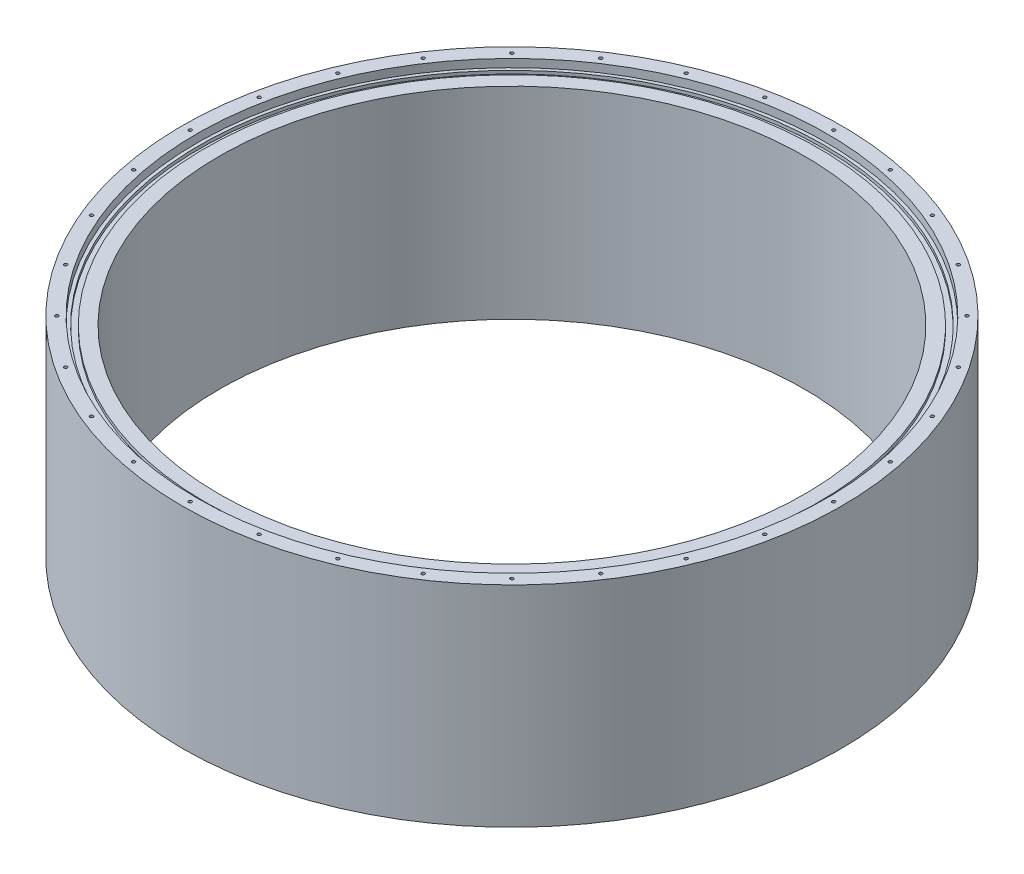
from build123d import *

# Parameters (mm, degrees)
SKETCH2_W                 = 4.1656
SKETCH2_H                 = 2.413
CIRPATTERN1_COUNT         = 32
F_5_0MM_DOWEL_HOLE1_D     = 5.05
F_5_0MM_DOWEL_HOLE1_DEPTH = 6
F_5_0MM_DOWEL_HOLE1_TIP   = 1.517173063


with BuildPart() as part:
    # Sketch1 → Revolve1 (revolve)
    with BuildSketch(Plane.XY, mode=Mode.PRIVATE) as revolve1_sk:
        Polygon((225.6, 74.685), (243, 74.685), (243, 80.885), (254, 80.885), (254, -80.885), (225.6, -80.885), align=None)
    revolve(revolve1_sk.sketch.rotate(Axis((0, 80.885, 0), (0, -1, 0)), 90), axis=Axis((0, 80.885, 0), (0, -1, 0)))

    # Sketch2 → Cut-Revolve1 (revolve, cut)
    with BuildSketch(Plane.XY, mode=Mode.PRIVATE) as cut_revolve1_sk:
        with Locations((238.4172, 73.4785)):
            Rectangle(SKETCH2_W, SKETCH2_H)
    revolve(cut_revolve1_sk.sketch.rotate(Axis((0, 80.885, 0), (0, -1, 0)), 90), axis=Axis((0, 80.885, 0), (0, -1, 0)), mode=Mode.SUBTRACT)

    # Sketch4 → M3x0.5 Tapped Hole1 (revolve, cut)
    with BuildSketch(Plane(origin=(248, 80.885, 0), x_dir=(0, 0, 1), z_dir=(1, 0, 0))):
        Polygon((0, 0), (0, 10.251075774), (1.25, 9.5), (1.25, 0), align=None)
    m3x0_5_tapped_hole1 = revolve(axis=Axis((248, 87.235, 0), (0, -1, 0)), mode=Mode.SUBTRACT)

    # CirPattern1: M3x0.5 Tapped Hole1 ×32 about axis
    cirpattern1_axis = Axis((0, 0, 0), (0, 1, 0))
    for i in range(1, CIRPATTERN1_COUNT):
        add(m3x0_5_tapped_hole1.rotate(cirpattern1_axis, i * 360 / CIRPATTERN1_COUNT), mode=Mode.SUBTRACT)

    # Mirror1: M3x0.5 Tapped Hole1 across plane
    add(m3x0_5_tapped_hole1.mirror(Plane.ZX), mode=Mode.SUBTRACT)

    # Mirror1 copy 1 sketch → Mirror1 copy 1 (revolve, cut)
    with BuildSketch(Plane(origin=(243.23474954, -80.885, -48.38239986), x_dir=(0.19509032201612825, 0, 0.9807852804032304), z_dir=(0.9807852804032304, 0, -0.19509032201612825))):
        Polygon((0, 0), (0, -10.251075774), (1.25, -9.5), (1.25, 0), align=None)
    revolve(axis=Axis((243.23474954, -87.235, -48.38239986), (0, -1, 0)), mode=Mode.SUBTRACT)

    # Mirror1 copy 2 sketch → Mirror1 copy 2 (revolve, cut)
    with BuildSketch(Plane(origin=(229.122124063, -80.885, -94.905491227), x_dir=(0.3826834323650898, 0, 0.9238795325112867), z_dir=(0.9238795325112867, 0, -0.3826834323650898))):
        Polygon((0, 0), (0, -10.251075774), (1.25, -9.5), (1.25, 0), align=None)
    revolve(axis=Axis((229.122124063, -87.235, -94.905491227), (0, -1, 0)), mode=Mode.SUBTRACT)

    # Mirror1 copy 3 sketch → Mirror1 copy 3 (revolve, cut)
    with BuildSketch(Plane(origin=(206.204463851, -80.885, -137.781417789), x_dir=(0.5555702330196022, 0, 0.8314696123025452), z_dir=(0.8314696123025452, 0, -0.5555702330196022))):
        Polygon((0, 0), (0, -10.251075774), (1.25, -9.5), (1.25, 0), align=None)
    revolve(axis=Axis((206.204463851, -87.235, -137.781417789), (0, -1, 0)), mode=Mode.SUBTRACT)

    # Mirror1 copy 4 sketch → Mirror1 copy 4 (revolve, cut)
    with BuildSketch(Plane(origin=(175.362481734, -80.885, -175.362481734), x_dir=(0.7071067811865475, 0, 0.7071067811865476), z_dir=(0.7071067811865476, 0, -0.7071067811865475))):
        Polygon((0, 0), (0, -10.251075774), (1.25, -9.5), (1.25, 0), align=None)
    revolve(axis=Axis((175.362481734, -87.235, -175.362481734), (0, -1, 0)), mode=Mode.SUBTRACT)

    # Mirror1 copy 5 sketch → Mirror1 copy 5 (revolve, cut)
    with BuildSketch(Plane(origin=(137.781417789, -80.885, -206.204463851), x_dir=(0.8314696123025452, 0, 0.5555702330196023), z_dir=(0.5555702330196023, 0, -0.8314696123025452))):
        Polygon((0, 0), (0, -10.251075774), (1.25, -9.5), (1.25, 0), align=None)
    revolve(axis=Axis((137.781417789, -87.235, -206.204463851), (0, -1, 0)), mode=Mode.SUBTRACT)

    # Mirror1 copy 6 sketch → Mirror1 copy 6 (revolve, cut)
    with BuildSketch(Plane(origin=(94.905491227, -80.885, -229.122124063), x_dir=(0.9238795325112867, 0, 0.38268343236508984), z_dir=(0.38268343236508984, 0, -0.9238795325112867))):
        Polygon((0, 0), (0, -10.251075774), (1.25, -9.5), (1.25, 0), align=None)
    revolve(axis=Axis((94.905491227, -87.235, -229.122124063), (0, -1, 0)), mode=Mode.SUBTRACT)

    # Mirror1 copy 7 sketch → Mirror1 copy 7 (revolve, cut)
    with BuildSketch(Plane(origin=(48.38239986, -80.885, -243.23474954), x_dir=(0.9807852804032304, 0, 0.19509032201612833), z_dir=(0.19509032201612833, 0, -0.9807852804032304))):
        Polygon((0, 0), (0, -10.251075774), (1.25, -9.5), (1.25, 0), align=None)
    revolve(axis=Axis((48.38239986, -87.235, -243.23474954), (0, -1, 0)), mode=Mode.SUBTRACT)

    # Mirror1 copy 8 sketch → Mirror1 copy 8 (revolve, cut)
    with BuildSketch(Plane(origin=(0, -80.885, -248), x_dir=(1, 0, 0), z_dir=(0, 0, -1))):
        Polygon((0, 0), (0, -10.251075774), (1.25, -9.5), (1.25, 0), align=None)
    revolve(axis=Axis((0, -87.235, -248), (0, -1, 0)), mode=Mode.SUBTRACT)

    # Mirror1 copy 9 sketch → Mirror1 copy 9 (revolve, cut)
    with BuildSketch(Plane(origin=(-48.38239986, -80.885, -243.23474954), x_dir=(0.9807852804032304, 0, -0.1950903220161282), z_dir=(-0.1950903220161282, 0, -0.9807852804032304))):
        Polygon((0, 0), (0, -10.251075774), (1.25, -9.5), (1.25, 0), align=None)
    revolve(axis=Axis((-48.38239986, -87.235, -243.23474954), (0, -1, 0)), mode=Mode.SUBTRACT)

    # Mirror1 copy 10 sketch → Mirror1 copy 10 (revolve, cut)
    with BuildSketch(Plane(origin=(-94.905491227, -80.885, -229.122124063), x_dir=(0.9238795325112867, 0, -0.3826834323650897), z_dir=(-0.3826834323650897, 0, -0.9238795325112867))):
        Polygon((0, 0), (0, -10.251075774), (1.25, -9.5), (1.25, 0), align=None)
    revolve(axis=Axis((-94.905491227, -87.235, -229.122124063), (0, -1, 0)), mode=Mode.SUBTRACT)

    # Mirror1 copy 11 sketch → Mirror1 copy 11 (revolve, cut)
    with BuildSketch(Plane(origin=(-137.781417789, -80.885, -206.204463851), x_dir=(0.8314696123025451, 0, -0.5555702330196023), z_dir=(-0.5555702330196023, 0, -0.8314696123025451))):
        Polygon((0, 0), (0, -10.251075774), (1.25, -9.5), (1.25, 0), align=None)
    revolve(axis=Axis((-137.781417789, -87.235, -206.204463851), (0, -1, 0)), mode=Mode.SUBTRACT)

    # Mirror1 copy 12 sketch → Mirror1 copy 12 (revolve, cut)
    with BuildSketch(Plane(origin=(-175.362481734, -80.885, -175.362481734), x_dir=(0.7071067811865476, 0, -0.7071067811865475), z_dir=(-0.7071067811865475, 0, -0.7071067811865476))):
        Polygon((0, 0), (0, -10.251075774), (1.25, -9.5), (1.25, 0), align=None)
    revolve(axis=Axis((-175.362481734, -87.235, -175.362481734), (0, -1, 0)), mode=Mode.SUBTRACT)

    # Mirror1 copy 13 sketch → Mirror1 copy 13 (revolve, cut)
    with BuildSketch(Plane(origin=(-206.204463851, -80.885, -137.781417789), x_dir=(0.5555702330196022, 0, -0.8314696123025453), z_dir=(-0.8314696123025453, 0, -0.5555702330196022))):
        Polygon((0, 0), (0, -10.251075774), (1.25, -9.5), (1.25, 0), align=None)
    revolve(axis=Axis((-206.204463851, -87.235, -137.781417789), (0, -1, 0)), mode=Mode.SUBTRACT)

    # Mirror1 copy 14 sketch → Mirror1 copy 14 (revolve, cut)
    with BuildSketch(Plane(origin=(-229.122124063, -80.885, -94.905491227), x_dir=(0.3826834323650899, 0, -0.9238795325112867), z_dir=(-0.9238795325112867, 0, -0.3826834323650899))):
        Polygon((0, 0), (0, -10.251075774), (1.25, -9.5), (1.25, 0), align=None)
    revolve(axis=Axis((-229.122124063, -87.235, -94.905491227), (0, -1, 0)), mode=Mode.SUBTRACT)

    # Mirror1 copy 15 sketch → Mirror1 copy 15 (revolve, cut)
    with BuildSketch(Plane(origin=(-243.23474954, -80.885, -48.38239986), x_dir=(0.19509032201612816, 0, -0.9807852804032304), z_dir=(-0.9807852804032304, 0, -0.19509032201612816))):
        Polygon((0, 0), (0, -10.251075774), (1.25, -9.5), (1.25, 0), align=None)
    revolve(axis=Axis((-243.23474954, -87.235, -48.38239986), (0, -1, 0)), mode=Mode.SUBTRACT)

    # Mirror1 copy 16 sketch → Mirror1 copy 16 (revolve, cut)
    with BuildSketch(Plane(origin=(-248, -80.885, 0), x_dir=(0, 0, -1), z_dir=(-1, 0, 0))):
        Polygon((0, 0), (0, -10.251075774), (1.25, -9.5), (1.25, 0), align=None)
    revolve(axis=Axis((-248, -87.235, 0), (0, -1, 0)), mode=Mode.SUBTRACT)

    # Mirror1 copy 17 sketch → Mirror1 copy 17 (revolve, cut)
    with BuildSketch(Plane(origin=(-243.23474954, -80.885, 48.38239986), x_dir=(-0.19509032201612836, 0, -0.9807852804032304), z_dir=(-0.9807852804032304, 0, 0.19509032201612836))):
        Polygon((0, 0), (0, -10.251075774), (1.25, -9.5), (1.25, 0), align=None)
    revolve(axis=Axis((-243.23474954, -87.235, 48.38239986), (0, -1, 0)), mode=Mode.SUBTRACT)

    # Mirror1 copy 18 sketch → Mirror1 copy 18 (revolve, cut)
    with BuildSketch(Plane(origin=(-229.122124063, -80.885, 94.905491227), x_dir=(-0.38268343236508967, 0, -0.9238795325112868), z_dir=(-0.9238795325112868, 0, 0.38268343236508967))):
        Polygon((0, 0), (0, -10.251075774), (1.25, -9.5), (1.25, 0), align=None)
    revolve(axis=Axis((-229.122124063, -87.235, 94.905491227), (0, -1, 0)), mode=Mode.SUBTRACT)

    # Mirror1 copy 19 sketch → Mirror1 copy 19 (revolve, cut)
    with BuildSketch(Plane(origin=(-206.204463851, -80.885, 137.781417789), x_dir=(-0.5555702330196023, 0, -0.8314696123025452), z_dir=(-0.8314696123025452, 0, 0.5555702330196023))):
        Polygon((0, 0), (0, -10.251075774), (1.25, -9.5), (1.25, 0), align=None)
    revolve(axis=Axis((-206.204463851, -87.235, 137.781417789), (0, -1, 0)), mode=Mode.SUBTRACT)

    # Mirror1 copy 20 sketch → Mirror1 copy 20 (revolve, cut)
    with BuildSketch(Plane(origin=(-175.362481734, -80.885, 175.362481734), x_dir=(-0.7071067811865475, 0, -0.7071067811865477), z_dir=(-0.7071067811865477, 0, 0.7071067811865475))):
        Polygon((0, 0), (0, -10.251075774), (1.25, -9.5), (1.25, 0), align=None)
    revolve(axis=Axis((-175.362481734, -87.235, 175.362481734), (0, -1, 0)), mode=Mode.SUBTRACT)

    # Mirror1 copy 21 sketch → Mirror1 copy 21 (revolve, cut)
    with BuildSketch(Plane(origin=(-137.781417789, -80.885, 206.204463851), x_dir=(-0.8314696123025452, 0, -0.5555702330196022), z_dir=(-0.5555702330196022, 0, 0.8314696123025452))):
        Polygon((0, 0), (0, -10.251075774), (1.25, -9.5), (1.25, 0), align=None)
    revolve(axis=Axis((-137.781417789, -87.235, 206.204463851), (0, -1, 0)), mode=Mode.SUBTRACT)

    # Mirror1 copy 22 sketch → Mirror1 copy 22 (revolve, cut)
    with BuildSketch(Plane(origin=(-94.905491227, -80.885, 229.122124063), x_dir=(-0.9238795325112868, 0, -0.3826834323650895), z_dir=(-0.3826834323650895, 0, 0.9238795325112868))):
        Polygon((0, 0), (0, -10.251075774), (1.25, -9.5), (1.25, 0), align=None)
    revolve(axis=Axis((-94.905491227, -87.235, 229.122124063), (0, -1, 0)), mode=Mode.SUBTRACT)

    # Mirror1 copy 23 sketch → Mirror1 copy 23 (revolve, cut)
    with BuildSketch(Plane(origin=(-48.38239986, -80.885, 243.23474954), x_dir=(-0.9807852804032303, 0, -0.19509032201612866), z_dir=(-0.19509032201612866, 0, 0.9807852804032303))):
        Polygon((0, 0), (0, -10.251075774), (1.25, -9.5), (1.25, 0), align=None)
    revolve(axis=Axis((-48.38239986, -87.235, 243.23474954), (0, -1, 0)), mode=Mode.SUBTRACT)

    # Mirror1 copy 24 sketch → Mirror1 copy 24 (revolve, cut)
    with BuildSketch(Plane(origin=(0, -80.885, 248), x_dir=(-1, 0, 0), z_dir=(0, 0, 1))):
        Polygon((0, 0), (0, -10.251075774), (1.25, -9.5), (1.25, 0), align=None)
    revolve(axis=Axis((0, -87.235, 248), (0, -1, 0)), mode=Mode.SUBTRACT)

    # Mirror1 copy 25 sketch → Mirror1 copy 25 (revolve, cut)
    with BuildSketch(Plane(origin=(48.38239986, -80.885, 243.23474954), x_dir=(-0.9807852804032304, 0, 0.1950903220161283), z_dir=(0.1950903220161283, 0, 0.9807852804032304))):
        Polygon((0, 0), (0, -10.251075774), (1.25, -9.5), (1.25, 0), align=None)
    revolve(axis=Axis((48.38239986, -87.235, 243.23474954), (0, -1, 0)), mode=Mode.SUBTRACT)

    # Mirror1 copy 26 sketch → Mirror1 copy 26 (revolve, cut)
    with BuildSketch(Plane(origin=(94.905491227, -80.885, 229.122124063), x_dir=(-0.9238795325112866, 0, 0.38268343236509), z_dir=(0.38268343236509, 0, 0.9238795325112866))):
        Polygon((0, 0), (0, -10.251075774), (1.25, -9.5), (1.25, 0), align=None)
    revolve(axis=Axis((94.905491227, -87.235, 229.122124063), (0, -1, 0)), mode=Mode.SUBTRACT)

    # Mirror1 copy 27 sketch → Mirror1 copy 27 (revolve, cut)
    with BuildSketch(Plane(origin=(137.781417789, -80.885, 206.204463851), x_dir=(-0.8314696123025455, 0, 0.5555702330196018), z_dir=(0.5555702330196018, 0, 0.8314696123025455))):
        Polygon((0, 0), (0, -10.251075774), (1.25, -9.5), (1.25, 0), align=None)
    revolve(axis=Axis((137.781417789, -87.235, 206.204463851), (0, -1, 0)), mode=Mode.SUBTRACT)

    # Mirror1 copy 28 sketch → Mirror1 copy 28 (revolve, cut)
    with BuildSketch(Plane(origin=(175.362481734, -80.885, 175.362481734), x_dir=(-0.7071067811865477, 0, 0.7071067811865474), z_dir=(0.7071067811865474, 0, 0.7071067811865477))):
        Polygon((0, 0), (0, -10.251075774), (1.25, -9.5), (1.25, 0), align=None)
    revolve(axis=Axis((175.362481734, -87.235, 175.362481734), (0, -1, 0)), mode=Mode.SUBTRACT)

    # Mirror1 copy 29 sketch → Mirror1 copy 29 (revolve, cut)
    with BuildSketch(Plane(origin=(206.204463851, -80.885, 137.781417789), x_dir=(-0.5555702330196022, 0, 0.8314696123025452), z_dir=(0.8314696123025452, 0, 0.5555702330196022))):
        Polygon((0, 0), (0, -10.251075774), (1.25, -9.5), (1.25, 0), align=None)
    revolve(axis=Axis((206.204463851, -87.235, 137.781417789), (0, -1, 0)), mode=Mode.SUBTRACT)

    # Mirror1 copy 30 sketch → Mirror1 copy 30 (revolve, cut)
    with BuildSketch(Plane(origin=(229.122124063, -80.885, 94.905491227), x_dir=(-0.38268343236508956, 0, 0.9238795325112868), z_dir=(0.9238795325112868, 0, 0.38268343236508956))):
        Polygon((0, 0), (0, -10.251075774), (1.25, -9.5), (1.25, 0), align=None)
    revolve(axis=Axis((229.122124063, -87.235, 94.905491227), (0, -1, 0)), mode=Mode.SUBTRACT)

    # Mirror1 copy 31 sketch → Mirror1 copy 31 (revolve, cut)
    with BuildSketch(Plane(origin=(243.23474954, -80.885, 48.38239986), x_dir=(-0.19509032201612872, 0, 0.9807852804032303), z_dir=(0.9807852804032303, 0, 0.19509032201612872))):
        Polygon((0, 0), (0, -10.251075774), (1.25, -9.5), (1.25, 0), align=None)
    revolve(axis=Axis((243.23474954, -87.235, 48.38239986), (0, -1, 0)), mode=Mode.SUBTRACT)

    # Ø5.0mm Dowel Hole1
    with Locations(Plane(origin=(0, -80.885, 0), x_dir=(-1, 0, 0), z_dir=(0, -1, 0))):
        with Locations((23.673900872, -245.862860997), (-23.673900872, 245.862860997)):
            Hole(F_5_0MM_DOWEL_HOLE1_D / 2, depth=F_5_0MM_DOWEL_HOLE1_DEPTH)
            with Locations((0, 0, -(F_5_0MM_DOWEL_HOLE1_DEPTH + F_5_0MM_DOWEL_HOLE1_TIP / 2))):  # 118° drill point
                Cone(0, F_5_0MM_DOWEL_HOLE1_D / 2, F_5_0MM_DOWEL_HOLE1_TIP, mode=Mode.SUBTRACT)


solid = part.part
